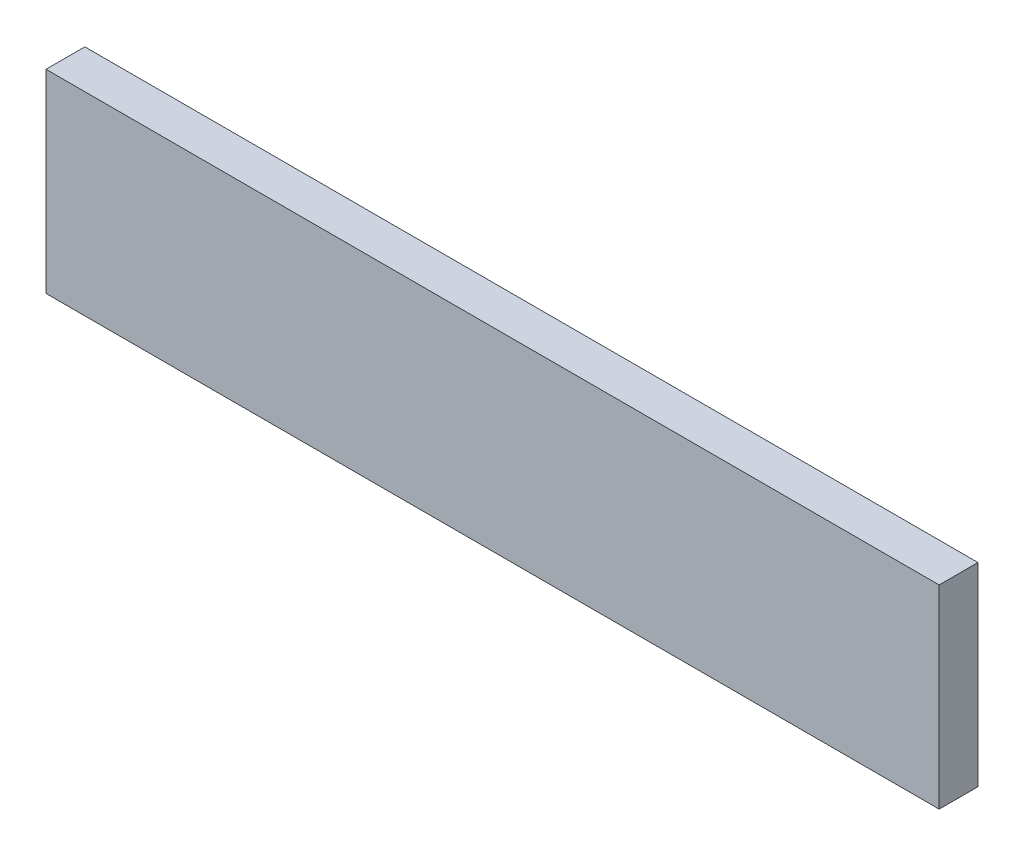
from build123d import *

# Parameters (mm, degrees)
SKETCH_1_W      = 230
SKETCH_1_H      = 50
EXTRUDE_1_DEPTH = 10


with BuildPart() as part:
    # 草图1 → 凸台-拉伸1 (new body)
    with BuildSketch(Plane.XY):
        with Locations((115, 25)):
            Rectangle(SKETCH_1_W, SKETCH_1_H)
    extrude(amount=EXTRUDE_1_DEPTH)


solid = part.part
